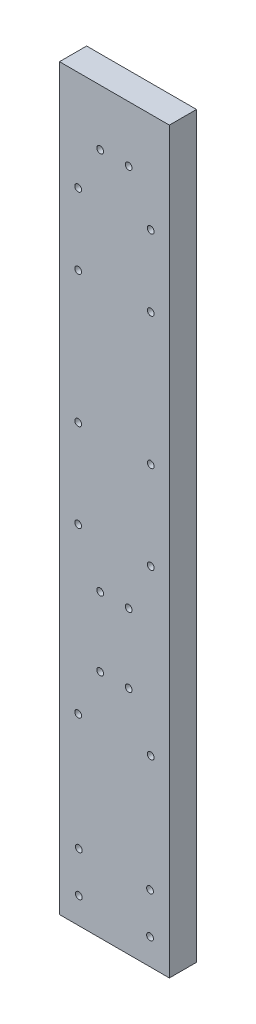
from build123d import *

# Parameters (mm, degrees)
SKETCH1_W           = 16.2
SKETCH1_H           = 108.91
SKETCH1_R           = 0.5
BOSS_EXTRUDE1_DEPTH = 4


with BuildPart() as part:
    # Sketch1 → Boss-Extrude1 (new body)
    with BuildSketch(Plane.XY):
        with Locations((8.1, 54.455)):
            Rectangle(SKETCH1_W, SKETCH1_H)
        with Locations((13.45, 51.21)):
            Circle(SKETCH1_R, mode=Mode.SUBTRACT)
        with Locations((10.2, 44.21)):
            Circle(SKETCH1_R, mode=Mode.SUBTRACT)
        with Locations((10.2, 100.66)):
            Circle(SKETCH1_R, mode=Mode.SUBTRACT)
        with Locations((2.75, 94.16)):
            Circle(SKETCH1_R, mode=Mode.SUBTRACT)
        with Locations((6, 44.21)):
            Circle(SKETCH1_R, mode=Mode.SUBTRACT)
        with Locations((2.75, 27)):
            Circle(SKETCH1_R, mode=Mode.SUBTRACT)
        with Locations((2.75, 83.66)):
            Circle(SKETCH1_R, mode=Mode.SUBTRACT)
        with Locations((2.75, 51.21)):
            Circle(SKETCH1_R, mode=Mode.SUBTRACT)
        with Locations((13.45, 64.21)):
            Circle(SKETCH1_R, mode=Mode.SUBTRACT)
        with Locations((6, 34)):
            Circle(SKETCH1_R, mode=Mode.SUBTRACT)
        with Locations((13.45, 94.16)):
            Circle(SKETCH1_R, mode=Mode.SUBTRACT)
        with Locations((13.45, 83.66)):
            Circle(SKETCH1_R, mode=Mode.SUBTRACT)
        with Locations((6, 100.66)):
            Circle(SKETCH1_R, mode=Mode.SUBTRACT)
        with Locations((10.2, 34)):
            Circle(SKETCH1_R, mode=Mode.SUBTRACT)
        with Locations((2.75, 64.21)):
            Circle(SKETCH1_R, mode=Mode.SUBTRACT)
        with Locations((13.45, 27)):
            Circle(SKETCH1_R, mode=Mode.SUBTRACT)
        with Locations((2.85, 9.846448831)):
            Circle(SKETCH1_R, mode=Mode.SUBTRACT)
        with Locations(Location((13.35, 9.846448831, 0), (0, 0, 180))):
            Circle(SKETCH1_R, mode=Mode.SUBTRACT)
        with Locations(Location((13.35, 3.846448831, 0), (0, 0, 180))):
            Circle(SKETCH1_R, mode=Mode.SUBTRACT)
        with Locations((2.85, 3.846448831)):
            Circle(SKETCH1_R, mode=Mode.SUBTRACT)
    extrude(amount=BOSS_EXTRUDE1_DEPTH)


solid = part.part
